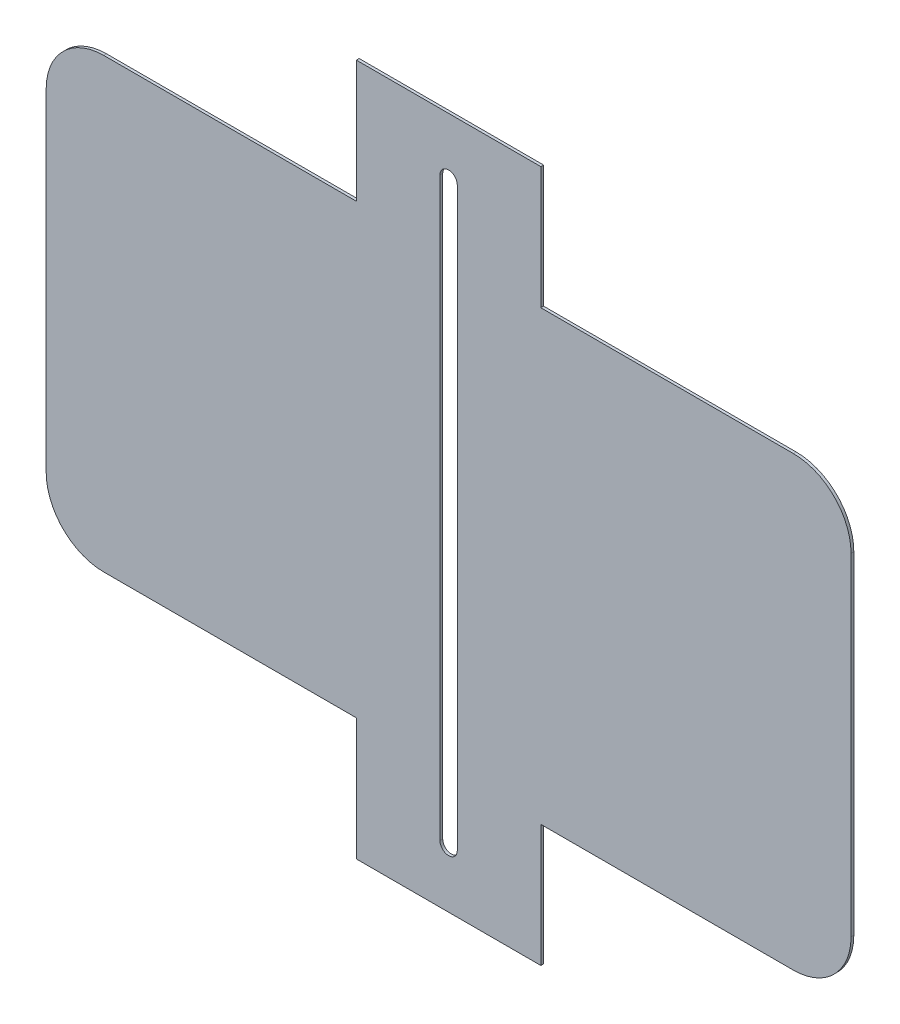
from build123d import *

# Parameters (mm, degrees)
EXTRUDE_1_DEPTH     = 0.24
CUT_EXTRUDE_1_DEPTH = 49.415468603


with BuildPart() as part:
    # 草圖1 → 填料-伸長1 (new body)
    with BuildSketch(Plane.XY):
        Polygon((8, 30), (-8, 30), (-8, 20), (-38, 20), (-38, -20), (-8, -20), (-8, -30), (8, -30), (8, -20), (38, -20), (38, 20), (8, 20), align=None)
        with BuildLine():
            Line((-0.75, -25), (-0.75, 25))
            ThreePointArc((-0.75, 25), (0, 25.75), (0.75, 25))
            Line((0.75, 25), (0.75, -25))
            ThreePointArc((0.75, -25), (0, -25.75), (-0.75, -25))
        make_face(mode=Mode.SUBTRACT)
    extrude(amount=EXTRUDE_1_DEPTH)

    # 草圖2 → 除料-伸長1 (cut, through all)
    with BuildSketch(Plane.XY.offset(0.24)):
        with BuildLine():
            Line((-8, 20), (-38, 20))
            Line((-38, 20), (-38, -20))
            Line((-38, -20), (-8, -20))
            Line((-8, -20), (-8, -19.4))
            Line((-8, -19.4), (-29.9, -19.4))
            ThreePointArc((-29.9, -19.4), (-33.435533906, -17.935533906), (-34.9, -14.4))
            Line((-34.9, -14.4), (-34.9, 14.4))
            ThreePointArc((-34.9, 14.4), (-33.435533906, 17.935533906), (-29.9, 19.4))
            Line((-29.9, 19.4), (-8, 19.4))
            Line((-8, 19.4), (-8, 20))
        make_face()
        with BuildLine():
            Line((8, 19.4), (8, 20))
            Line((8, 20), (38, 20))
            Line((38, 20), (38, -20))
            Line((38, -20), (8, -20))
            Line((8, -20), (8, -19.4))
            Line((8, -19.4), (29.9, -19.4))
            ThreePointArc((29.9, -19.4), (33.435533906, -17.935533906), (34.9, -14.4))
            Line((34.9, -14.4), (34.9, 14.4))
            ThreePointArc((34.9, 14.4), (33.435533906, 17.935533906), (29.9, 19.4))
            Line((29.9, 19.4), (8, 19.4))
        make_face()
    extrude(amount=-CUT_EXTRUDE_1_DEPTH, mode=Mode.SUBTRACT)


solid = part.part
